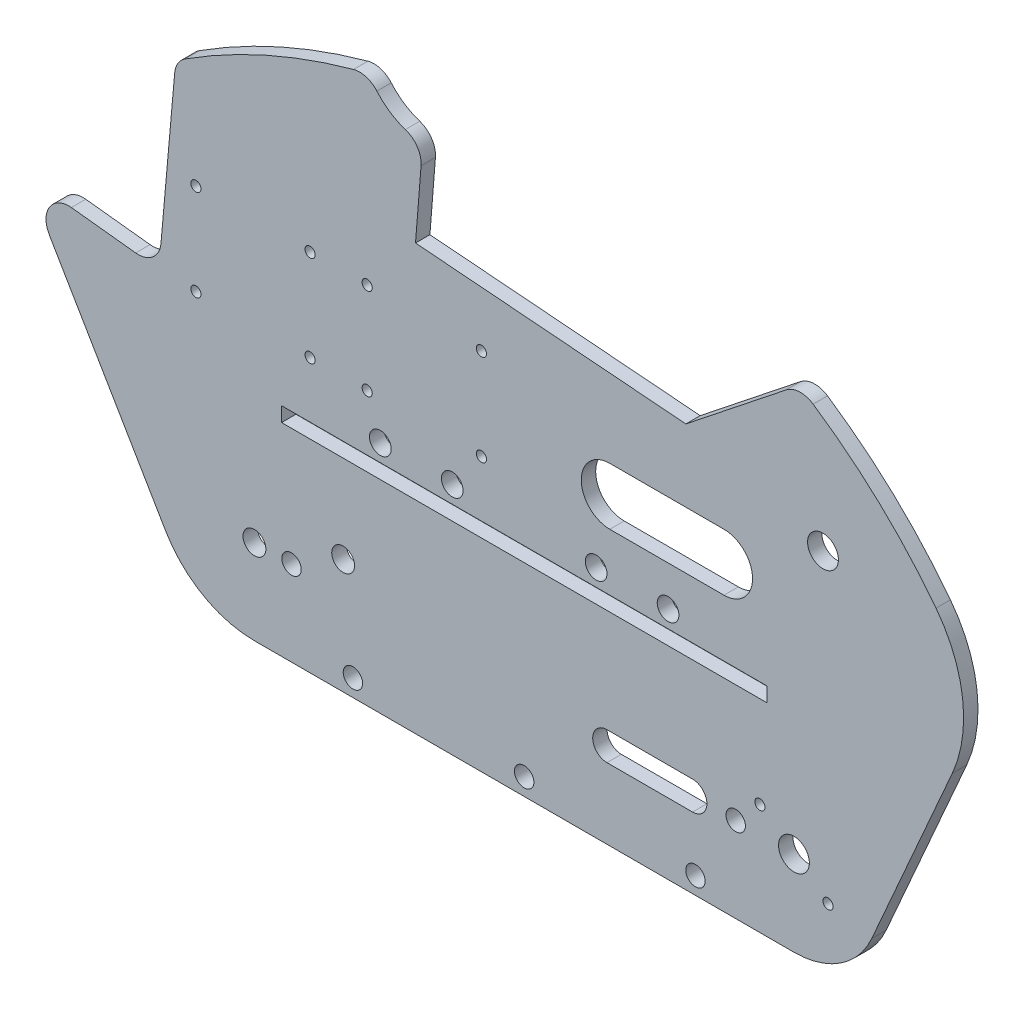
from build123d import *

# Parameters (mm, degrees)
SKETCH1_R           = 3.429
SKETCH1_R_2         = 2.54
BOSS_EXTRUDE1_DEPTH = 3.2004
SKETCH2_R           = 2.413
CUT_EXTRUDE1_DEPTH  = 3.2004
SKETCH3_R           = 2.159
CUT_EXTRUDE2_DEPTH  = 3.2004
SKETCH6_W           = 107.95
SKETCH6_H           = 3.2512
CUT_EXTRUDE3_DEPTH  = 3.2004
SKETCH7_R           = 3.429
CUT_EXTRUDE4_DEPTH  = 3.2004
CUT_EXTRUDE5_START  = -3.2004
CUT_EXTRUDE5_DEPTH  = 3.2004
CUT_EXTRUDE6_START  = -3.2004
CUT_EXTRUDE6_DEPTH  = 3.2004
BOSS_EXTRUDE2_DEPTH = 3.2004
SKETCH13_R          = 1.1303
CUT_EXTRUDE7_DEPTH  = 3.2004
CUT_EXTRUDE8_DEPTH  = 3.2004
FILLET1_R           = 5.08
SKETCH16_R          = 1.1303
CUT_EXTRUDE9_DEPTH  = 3.2004
SKETCH20_R          = 2.159
CUT_EXTRUDE11_DEPTH = 3.2004
CUT_EXTRUDE12_DEPTH = 3.2004
FILLET2_R           = 5.08


with BuildPart() as part:
    # Sketch1 → Boss-Extrude1 (new body)
    with BuildSketch(Plane.XY):
        with BuildLine():
            Line((0, 0), (120.015, 0))
            ThreePointArc((120.015, 0), (130.351788396, 3.075697789), (137.325636158, 11.302152592))
            Line((137.325636158, 11.302152592), (155.2575, 52.11572))
            ThreePointArc((155.2575, 52.11572), (157.54731739, 67.602183396), (151.630955452, 82.09599151))
            ThreePointArc((151.630955452, 82.09599151), (60.0075, 127.266502568), (-31.615955452, 82.09599151))
            ThreePointArc((-31.615955452, 82.09599151), (-37.53231739, 67.602183396), (-35.2425, 52.11572))
            Line((-35.2425, 52.11572), (-17.310636158, 11.302152592))
            ThreePointArc((-17.310636158, 11.302152592), (-10.336788396, 3.075697789), (0, 0))
        make_face()
        with Locations((120.015, 18.90776)):
            Circle(SKETCH1_R, mode=Mode.SUBTRACT)
        with Locations((0, 18.90776)):
            Circle(SKETCH1_R_2, mode=Mode.SUBTRACT)
        with Locations((19.734727626, 25.566426992)):
            Circle(SKETCH1_R_2, mode=Mode.SUBTRACT)
    extrude(amount=BOSS_EXTRUDE1_DEPTH)

    # Sketch2 → Cut-Extrude1 (cut)
    with BuildSketch(Plane(origin=(0, 0, 0), x_dir=(-1, 0, 0), z_dir=(0, 0, -1))):
        with Locations((-92.0115, 52.11572)):
            Circle(SKETCH2_R)
        with Locations((-76.0095, 52.11572)):
            Circle(SKETCH2_R)
        with Locations((-44.0055, 52.11572)):
            Circle(SKETCH2_R)
        with Locations((-28.0035, 52.11572)):
            Circle(SKETCH2_R)
    extrude(amount=-CUT_EXTRUDE1_DEPTH, mode=Mode.SUBTRACT)

    # Sketch3 → Cut-Extrude2 (cut)
    with BuildSketch(Plane.XY.offset(3.2004)):
        with Locations((21.9075, 3.81)):
            Circle(SKETCH3_R)
        with Locations((60.0075, 3.81)):
            Circle(SKETCH3_R)
        with Locations((98.1075, 3.81)):
            Circle(SKETCH3_R)
    extrude(amount=-CUT_EXTRUDE2_DEPTH, mode=Mode.SUBTRACT)

    # Sketch6 → Cut-Extrude3 (cut)
    with BuildSketch(Plane(origin=(0, 0, 0), x_dir=(-1, 0, 0), z_dir=(0, 0, -1))):
        with Locations((-60.0075, 46.68012)):
            Rectangle(SKETCH6_W, SKETCH6_H)
    extrude(amount=-CUT_EXTRUDE3_DEPTH, mode=Mode.SUBTRACT)

    # Sketch7 → Cut-Extrude4 (cut)
    with BuildSketch(Plane.XY.offset(3.2004)):
        with Locations((126.474462556, 80.535782848)):
            Circle(SKETCH7_R)
    extrude(amount=-CUT_EXTRUDE4_DEPTH, mode=Mode.SUBTRACT)

    # Sketch11 → Cut-Extrude5 (cut)
    with BuildSketch(Plane.XY.offset(3.2004).offset(CUT_EXTRUDE5_START)):
        with BuildLine():
            Line((121.158447362, 109.75190519), (95.966712331, 89.752651283))
            Line((95.966712331, 89.752651283), (35.832210764, 94.542990135))
            Line((35.832210764, 94.542990135), (38.27464621, 125.20358486))
            ThreePointArc((38.27464621, 125.20358486), (81.176702308, 125.310112932), (121.158447362, 109.75190519))
        make_face()
    extrude(amount=CUT_EXTRUDE5_DEPTH, mode=Mode.SUBTRACT)

    # Sketch12 → Cut-Extrude6 (cut)
    with BuildSketch(Plane.XY.offset(3.2004).offset(CUT_EXTRUDE6_START)):
        with BuildLine():
            Line((36.857132229, 114.618997738), (37.427852032, 114.573533967))
            Line((37.427852032, 114.573533967), (38.27464621, 125.20358486))
            ThreePointArc((38.27464621, 125.20358486), (31.851547204, 123.782382999), (25.51977184, 121.997828065))
            ThreePointArc((25.51977184, 121.997828065), (30.251350905, 116.868583991), (36.857132229, 114.618997738))
        make_face()
    extrude(amount=CUT_EXTRUDE6_DEPTH, mode=Mode.SUBTRACT)

    # Sketch14 → Boss-Extrude2 (add)
    with BuildSketch(Plane.XY.offset(3.2004)):
        with BuildLine():
            Line((-45.169534314, 54.57440881), (-19.78010381, 11.324779025))
            ThreePointArc((-19.78010381, 11.324779025), (-11.396305615, 3.031534227), (0, 0))
            ThreePointArc((0, 0), (-12.750544623, 66.33524155), (25.51977184, 121.997828065))
            ThreePointArc((25.51977184, 121.997828065), (-11.283339646, 106.926625279), (-42.217820701, 81.933265153))
            ThreePointArc((-42.217820701, 81.933265153), (-48.214081814, 68.741537884), (-45.169534314, 54.57440881))
        make_face()
    extrude(amount=-BOSS_EXTRUDE2_DEPTH)

    # Sketch13 → Cut-Extrude7 (cut)
    with BuildSketch(Plane.XY.offset(3.2004)):
        with Locations((50.4825, 81.07172)):
            Circle(SKETCH13_R)
        with Locations((50.4825, 60.75172)):
            Circle(SKETCH13_R)
        with Locations((25.0825, 60.75172)):
            Circle(SKETCH13_R)
        with Locations((25.0825, 81.07172)):
            Circle(SKETCH13_R)
        with Locations((12.3825, 81.07172)):
            Circle(SKETCH13_R)
        with Locations((12.3825, 60.75172)):
            Circle(SKETCH13_R)
        with Locations((-13.0175, 60.75172)):
            Circle(SKETCH13_R)
        with Locations((-13.0175, 81.07172)):
            Circle(SKETCH13_R)
    extrude(amount=-CUT_EXTRUDE7_DEPTH, mode=Mode.SUBTRACT)

    # Sketch15 → Cut-Extrude8 (cut)
    with BuildSketch(Plane.XY.offset(3.2004)):
        with BuildLine():
            Line((79.0575, 73.70572), (104.4575, 73.70572))
            ThreePointArc((104.4575, 73.70572), (110.8075, 67.35572), (104.4575, 61.00572))
            Line((104.4575, 61.00572), (79.0575, 61.00572))
            ThreePointArc((79.0575, 61.00572), (72.7075, 67.35572), (79.0575, 73.70572))
        make_face()
        with BuildLine():
            Line((78.4225, 22.08276), (97.4725, 22.08276))
            ThreePointArc((97.4725, 22.08276), (100.6475, 18.90776), (97.4725, 15.73276))
            Line((97.4725, 15.73276), (78.4225, 15.73276))
            ThreePointArc((78.4225, 15.73276), (75.2475, 18.90776), (78.4225, 22.08276))
        make_face()
    extrude(amount=-CUT_EXTRUDE8_DEPTH, mode=Mode.SUBTRACT)

    # Fillet1
    fillet1_edges = [part.edges().sort_by_distance(p)[0] for p in [
        (121.158447362, 109.75190519, 1.6002),
        (37.427852032, 114.573533967, 1.6002),
        (25.51977184, 121.997828065, 1.6002),
    ]]
    fillet(fillet1_edges, radius=FILLET1_R)

    # Sketch16 → Cut-Extrude9 (cut)
    with BuildSketch(Plane.XY.offset(3.2004)):
        with Locations((112.438115095, 24.679799513)):
            Circle(SKETCH16_R)
        with Locations((127.591884905, 13.135720487)):
            Circle(SKETCH16_R)
    extrude(amount=-CUT_EXTRUDE9_DEPTH, mode=Mode.SUBTRACT)

    # Sketch20 → Cut-Extrude11 (cut)
    with BuildSketch(Plane.XY.offset(3.2004)):
        with Locations((8.255, 18.90776)):
            Circle(SKETCH20_R)
        with Locations((107.05592, 18.90776)):
            Circle(SKETCH20_R)
    extrude(amount=-CUT_EXTRUDE11_DEPTH, mode=Mode.SUBTRACT)

    # Sketch21 → Cut-Extrude12 (cut)
    with BuildSketch(Plane(origin=(0, 0, 0), x_dir=(-1, 0, 0), z_dir=(0, 0, -1))):
        Polygon((16.731556446, 111.864036412), (21.254933404, 60.933416848), (65.105179276, 65.815561516), align=None)
    extrude(amount=-CUT_EXTRUDE12_DEPTH, mode=Mode.SUBTRACT)

    # Fillet2
    fillet2_edges = [part.edges().sort_by_distance(p)[0] for p in [
        (-48.229671102, 63.936696971, 1.6002),
        (-17.517967545, 103.009500331, 1.6002),
        (-21.254933404, 60.933416848, 1.6002),
    ]]
    fillet(fillet2_edges, radius=FILLET2_R)


solid = part.part
